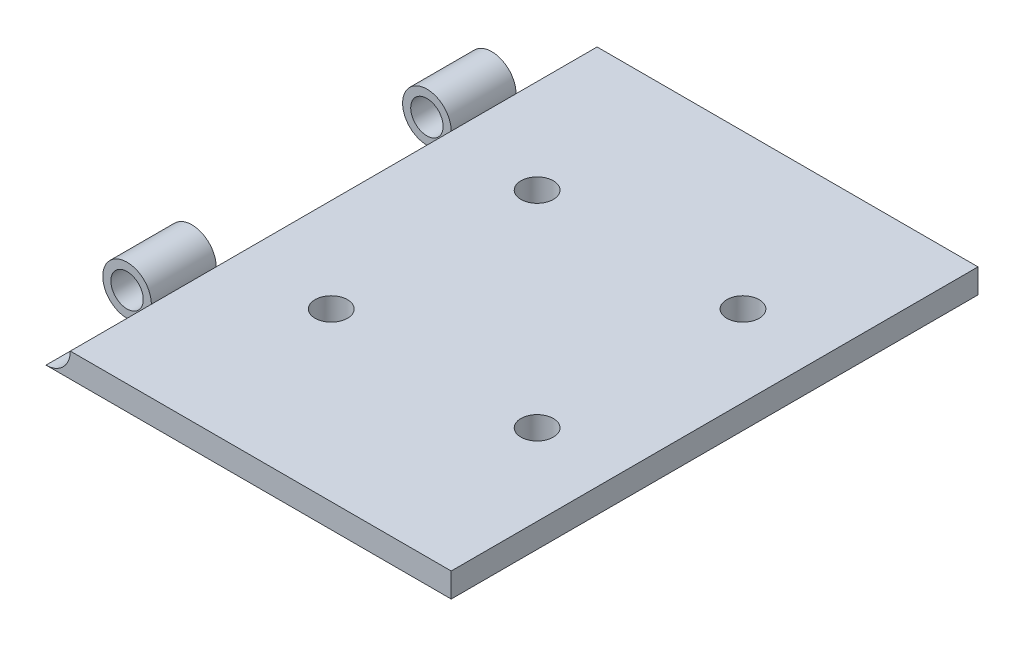
from build123d import *

# Parameters (mm, degrees)
SKETCH1_W           = 50
SKETCH1_H           = 65
BOSS_EXTRUDE1_DEPTH = 3
SKETCH4_R           = 3
CUT_EXTRUDE1_DEPTH  = 70
SKETCH5_R           = 3
BOSS_EXTRUDE3_DEPTH = 8
BOSS_EXTRUDE4_START = -8
SKETCH6_R           = 3
BOSS_EXTRUDE4_DEPTH = 8
SKETCH7_R           = 2
CUT_EXTRUDE2_DEPTH  = 68
SKETCH8_R           = 2
CUT_EXTRUDE3_DEPTH  = 38


with BuildPart() as part:
    # Sketch1 → Boss-Extrude1 (new body)
    with BuildSketch(Plane(origin=(0, 0, 0), x_dir=(1, 0, 0), z_dir=(0, 1, 0))):
        Rectangle(SKETCH1_W, SKETCH1_H)
    extrude(amount=BOSS_EXTRUDE1_DEPTH)

    # Sketch4 → Cut-Extrude1 (cut)
    with BuildSketch(Plane.XY.offset(32.5)):
        with Locations((-25, 3)):
            Circle(SKETCH4_R)
    extrude(amount=-CUT_EXTRUDE1_DEPTH, mode=Mode.SUBTRACT)

    # Sketch6 → Boss-Extrude4 (add)
    with BuildSketch(Plane(origin=(0, 0, -22.5), x_dir=(-1, 0, 0), z_dir=(0, 0, -1)).offset(BOSS_EXTRUDE4_START)):
        with Locations(Location((25, 3, 0), (0, 0, 180))):
            Circle(SKETCH6_R)
    extrude(amount=BOSS_EXTRUDE4_DEPTH)


with BuildPart() as body_2:
    # Sketch5 → Boss-Extrude3 (new body)
    with BuildSketch(Plane.XY.offset(22.5)):
        with Locations((-25, 3)):
            Circle(SKETCH5_R)
    extrude(amount=-BOSS_EXTRUDE3_DEPTH)


with BuildPart() as cut_extrude2_tool:
    # Sketch7 → Cut-Extrude2 (new body)
    with BuildSketch(Plane.XY.offset(22.5)):
        with Locations((-25, 3)):
            Circle(SKETCH7_R)
    extrude(amount=-CUT_EXTRUDE2_DEPTH)


with BuildPart() as part_1:
    add(part.part)

    # Cut-Extrude2: cut by cut_extrude2_tool
    add(cut_extrude2_tool.part, mode=Mode.SUBTRACT)

    # Sketch8 → Cut-Extrude3 (cut)
    with BuildSketch(Plane(origin=(0, 3, 0), x_dir=(1, 0, 0), z_dir=(0, 1, 0))):
        with Locations(Location((-10.4, 13.5, 0), (0, 0, 270))):
            Circle(SKETCH8_R)
        with Locations(Location((15, 13.5, 0), (0, 0, 270))):
            Circle(SKETCH8_R)
        with Locations(Location((15, -11.9, 0), (0, 0, 270))):
            Circle(SKETCH8_R)
        with Locations(Location((-10.4, -11.9, 0), (0, 0, 270))):
            Circle(SKETCH8_R)
    extrude(amount=-CUT_EXTRUDE3_DEPTH, mode=Mode.SUBTRACT)


with BuildPart() as body_2_1:
    add(body_2.part)

    # Cut-Extrude2: cut by cut_extrude2_tool
    add(cut_extrude2_tool.part, mode=Mode.SUBTRACT)


solid = Compound([part_1.part, body_2_1.part])
